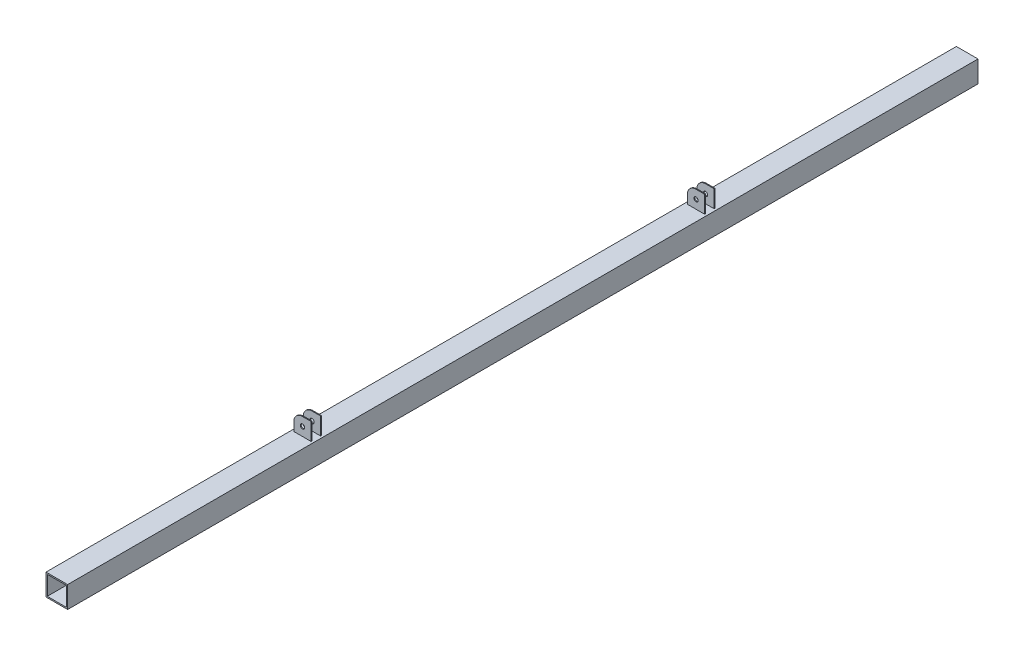
from build123d import *

# Parameters (mm, degrees)
SKETCH3_W           = 50
SKETCH3_H           = 50
SKETCH3_W_2         = 44
SKETCH3_H_2         = 44
BOSS_EXTRUDE1_DEPTH = 1052.5
SKETCH4_W           = 40
SKETCH4_H           = 2
BOSS_EXTRUDE2_DEPTH = 40
SKETCH5_R           = 5
CUT_EXTRUDE1_DEPTH  = 1000
FILLET1_R           = 20


with BuildPart() as part:
    # Sketch3 → Boss-Extrude1 (new, symmetric)
    with BuildSketch(Plane.XY):
        Rectangle(SKETCH3_W, SKETCH3_H)
        Rectangle(SKETCH3_W_2, SKETCH3_H_2, mode=Mode.SUBTRACT)
    extrude(amount=BOSS_EXTRUDE1_DEPTH, both=True)

    # Sketch4 → Boss-Extrude2 (add)
    with BuildSketch(Plane(origin=(0, 25, 0), x_dir=(1, 0, 0), z_dir=(0, 1, 0))):
        with Locations((0, 448.5)):
            Rectangle(SKETCH4_W, SKETCH4_H)
        with Locations((0, 426.5)):
            Rectangle(SKETCH4_W, SKETCH4_H)
        with Locations((0, -461.5)):
            Rectangle(SKETCH4_W, SKETCH4_H)
        with Locations((0, -483.5)):
            Rectangle(SKETCH4_W, SKETCH4_H)
    extrude(amount=BOSS_EXTRUDE2_DEPTH)

    # Sketch5 → Cut-Extrude1 (cut)
    with BuildSketch(Plane.XY.offset(484.5)):
        with Locations((0, 45)):
            Circle(SKETCH5_R)
    extrude(amount=-CUT_EXTRUDE1_DEPTH, mode=Mode.SUBTRACT)

    # Fillet1
    fillet1_edges = [part.edges().sort_by_distance(p)[0] for p in [
        (-20, 65, -448.5),
        (-20, 65, -426.5),
        (-20, 65, 461.5),
        (-20, 65, 483.5),
    ]]
    fillet(fillet1_edges, radius=FILLET1_R)


solid = part.part
